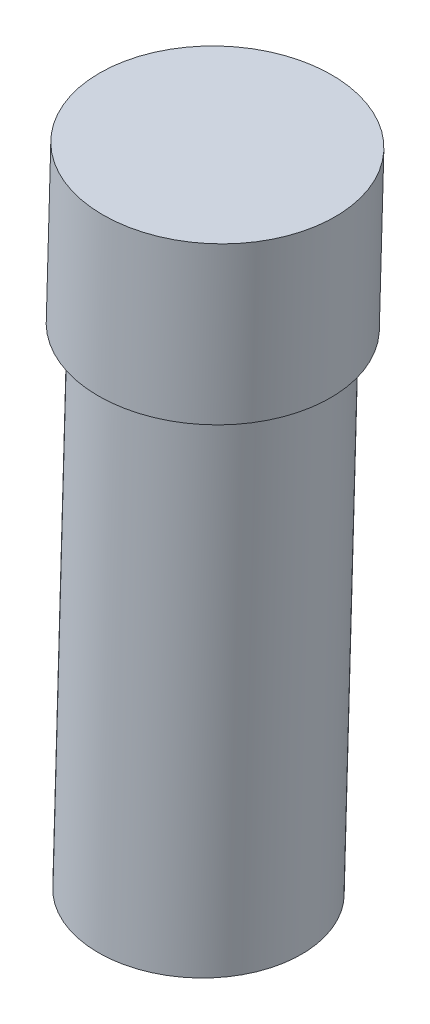
from build123d import *


with BuildPart() as part:
    # Esquisse1 → Révolution1 (revolve)
    with BuildSketch(Plane(origin=(0, 0, -134.221294922), x_dir=(-1, 0, 0), z_dir=(0, 0, -1)), mode=Mode.PRIVATE) as r_volution1_sk:
        Polygon((216.514306422, -43.297656342), (223.511408179, -43.096243837), (222.229314455, 1.443891658), (214.232626732, 1.213705938), (214.543520229, -9.586782525), (215.543106194, -9.55800931), align=None)
    revolve(r_volution1_sk.sketch.rotate(Axis((-223.517201065, -43.297489593, -134.221294922), (0.0287732149581037, 0.9995859653381368, 0)), 180), axis=Axis((-223.517201065, -43.297489593, -134.221294922), (0.0287732149581037, 0.9995859653381368, 0)))


solid = part.part
